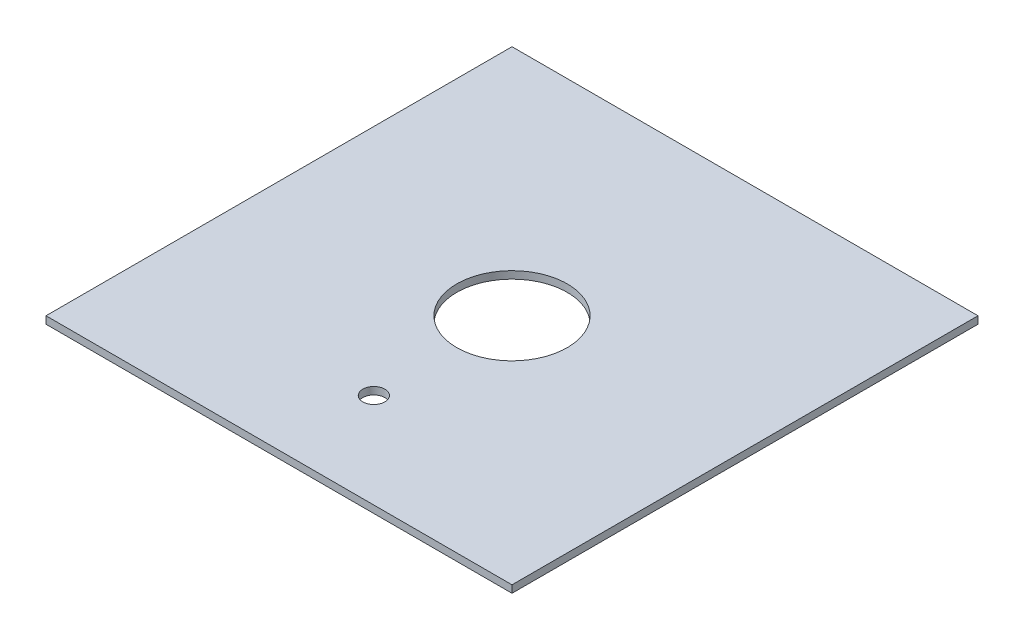
from build123d import *

# Parameters (mm, degrees)
SKETCH2_W           = 253
SKETCH2_H           = 253
BOSS_EXTRUDE1_DEPTH = 4
SKETCH3_R           = 6
SKETCH3_R_2         = 30
CUT_EXTRUDE1_DEPTH  = 179.942728268


with BuildPart() as part:
    # Sketch2 → Boss-Extrude1 (new body)
    with BuildSketch(Plane(origin=(0, 0, 0), x_dir=(1, 0, 0), z_dir=(0, 1, 0))):
        Rectangle(SKETCH2_W, SKETCH2_H)
    extrude(amount=BOSS_EXTRUDE1_DEPTH)

    # Sketch3 → Cut-Extrude1 (cut, through all)
    with BuildSketch(Plane(origin=(0, 4, 0), x_dir=(1, 0, 0), z_dir=(0, 1, 0))):
        with Locations(Location((0, -75, 0), (0, 0, 270))):
            Circle(SKETCH3_R)
        with Locations(Location((0, 0, 0), (0, 0, 270))):
            Circle(SKETCH3_R_2)
    extrude(amount=-CUT_EXTRUDE1_DEPTH, mode=Mode.SUBTRACT)


solid = part.part
